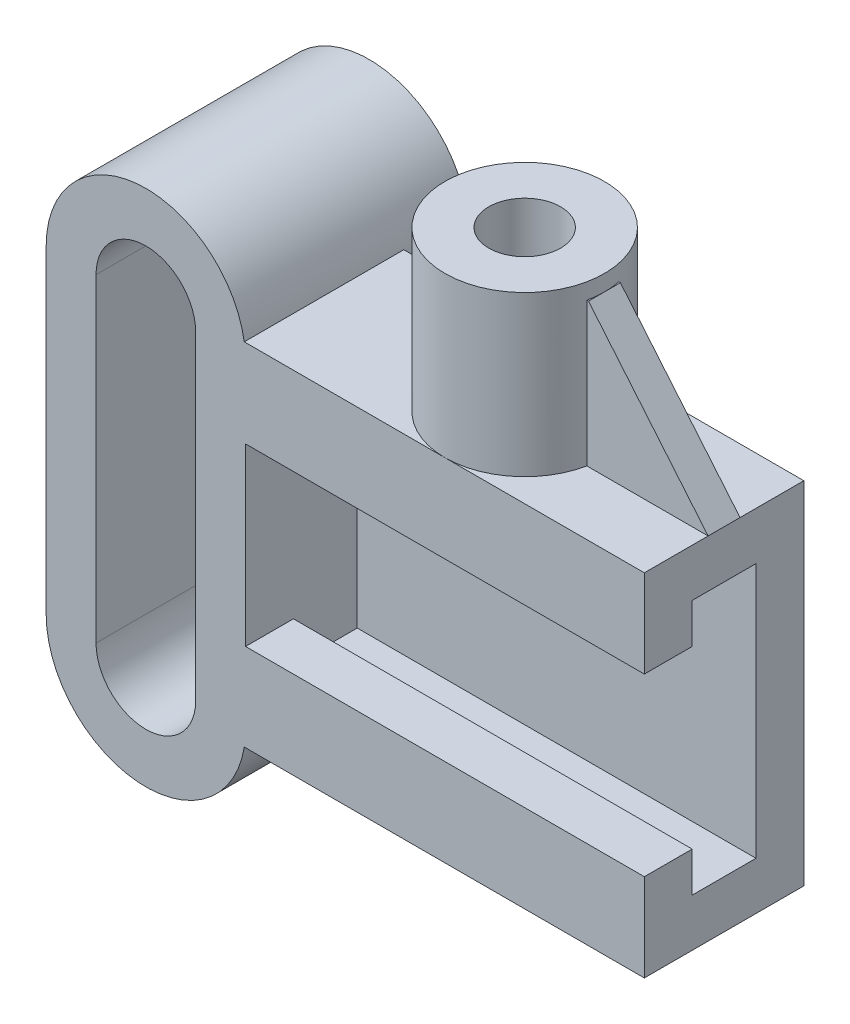
from build123d import *

# Parameters (mm, degrees)
BOSS_EXTRUDE1_DEPTH = 62.5
BOSS_EXTRUDE2_DEPTH = 28
CUT_EXTRUDE1_DEPTH  = 76.805672611
SKETCH5_R           = 10
BOSS_EXTRUDE3_DEPTH = 20
HOLE1_D             = 9
HOLE1_DEPTH         = 16
BOSS_EXTRUDE5_START = -10
BOSS_EXTRUDE5_DEPTH = 2


with BuildPart() as part:
    # Sketch1 → Boss-Extrude1 (new body)
    with BuildSketch(Plane(origin=(0, 0, 0), x_dir=(0, 0, -1), z_dir=(1, 0, 0))):
        Polygon((-14, 16), (-14, 11), (-20, 11), (-20, 22), (0, 22), (0, -22), (-20, -22), (-20, -11), (-14, -11), (-14, -16), (-6, -16), (-6, 16), align=None)
    extrude(amount=BOSS_EXTRUDE1_DEPTH)

    # Sketch3 → Boss-Extrude2 (add)
    with BuildSketch(Plane.XY.offset(20)):
        with BuildLine():
            Line((12.5, 20), (12.5, -20))
            ThreePointArc((12.5, -20), (0, -32.5), (-12.5, -20))
            Line((-12.5, -20), (-12.5, 20))
            ThreePointArc((-12.5, 20), (0, 32.5), (12.5, 20))
        make_face()
    extrude(amount=-BOSS_EXTRUDE2_DEPTH)

    # Sketch4 → Cut-Extrude1 (cut, through all)
    with BuildSketch(Plane.XY.offset(20)):
        with BuildLine():
            Line((6.25, 20), (6.25, -20))
            ThreePointArc((6.25, -20), (0, -26.25), (-6.25, -20))
            Line((-6.25, -20), (-6.25, 20))
            ThreePointArc((-6.25, 20), (0, 26.25), (6.25, 20))
        make_face()
    extrude(amount=-CUT_EXTRUDE1_DEPTH, mode=Mode.SUBTRACT)

    # Sketch5 → Boss-Extrude3 (add)
    with BuildSketch(Plane(origin=(0, 22, 0), x_dir=(1, 0, 0), z_dir=(0, 1, 0))):
        with Locations(Location((37.5, -10, 0), (0, 0, 270))):
            Circle(SKETCH5_R)
    extrude(amount=BOSS_EXTRUDE3_DEPTH)

    # Hole1
    with Locations(Plane(origin=(0, 42, 0), x_dir=(1, 0, 0), z_dir=(0, 1, 0))):
        with Locations((37.5, -10)):
            Hole(HOLE1_D / 2, depth=HOLE1_DEPTH)

    # Sketch9 → Boss-Extrude5 (add, symmetric)
    with BuildSketch(Plane.XY.offset(20).offset(BOSS_EXTRUDE5_START)):
        Polygon((47.5, 40), (62.5, 22), (47.5, 22), (46.5, 22), (46.5, 40), align=None)
    extrude(amount=BOSS_EXTRUDE5_DEPTH, both=True)


solid = part.part
